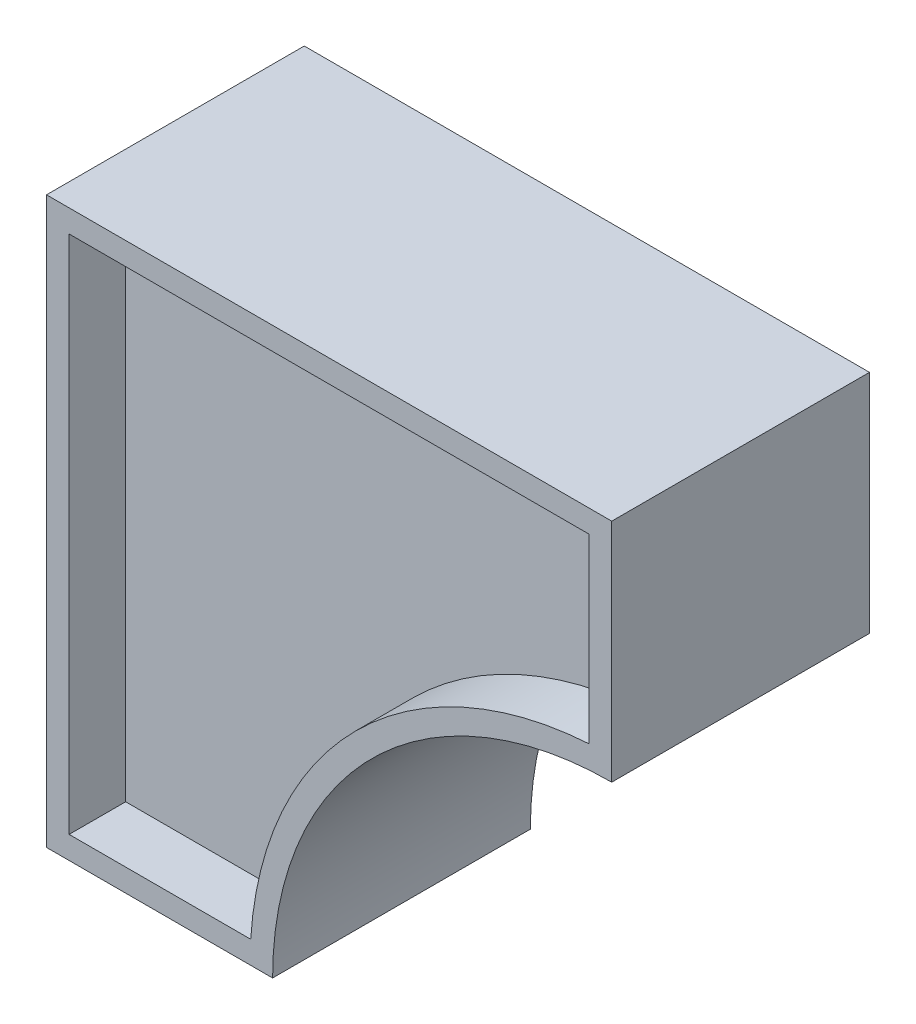
from build123d import *

# Parameters (mm, degrees)
BOSS_EXTRUDE2_DEPTH = 28.956
CUT_EXTRUDE1_DEPTH  = 6.35


with BuildPart() as part:
    # Sketch1 → Boss-Extrude2 (new body)
    with BuildSketch(Plane.XY):
        with BuildLine():
            Line((0, 0), (63.5, 0))
            Line((63.5, 0), (63.5, -25.4))
            ThreePointArc((63.5, -25.4), (36.559231637, -36.559231637), (25.4, -63.5))
            Line((25.4, -63.5), (0, -63.5))
            Line((0, -63.5), (0, 0))
        make_face()
    extrude(amount=BOSS_EXTRUDE2_DEPTH)

    # Sketch2 → Cut-Extrude1 (cut)
    with BuildSketch(Plane.XY.offset(28.956)):
        with BuildLine():
            Line((2.54, -2.54), (2.54, -60.96))
            Line((2.54, -60.96), (22.939452666, -60.96))
            ThreePointArc((22.939452666, -60.96), (34.763180413, -34.763180413), (60.96, -22.939452666))
            Line((60.96, -22.939452666), (60.96, -2.54))
            Line((60.96, -2.54), (2.54, -2.54))
        make_face()
    extrude(amount=-CUT_EXTRUDE1_DEPTH, mode=Mode.SUBTRACT)


solid = part.part
